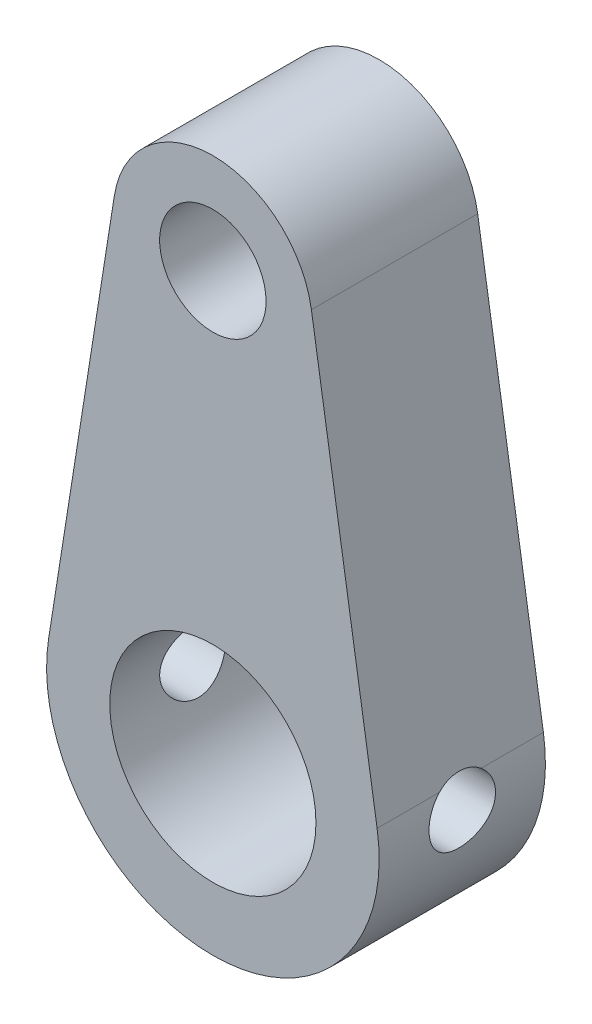
from build123d import *

# Parameters (mm, degrees)
CROQUIS1_R                 = 3.1
CROQUIS1_R_2               = 1.6
SALIENTE_EXTRUIR1_DEPTH    = 5
CORTAR_EXTRUIR1_DEPTH      = 18.33749982
CORTAR_EXTRUIR1_DEPTH_BACK = 18.33749982
CROQUIS3_R                 = 1


with BuildPart() as part:
    # Croquis1 → Saliente-Extruir1 (new body)
    with BuildSketch(Plane.XY):
        with BuildLine():
            Line((-4.938876333, 0.779423227), (-2.9633258, 13.297653936))
            ThreePointArc((-2.9633258, 13.297653936), (0, 15.83), (2.9633258, 13.297653936))
            Line((2.9633258, 13.297653936), (4.938876333, 0.779423227))
            ThreePointArc((4.938876333, 0.779423227), (0, -5), (-4.938876333, 0.779423227))
        make_face()
        Circle(CROQUIS1_R, mode=Mode.SUBTRACT)
        with Locations((0, 12.83)):
            Circle(CROQUIS1_R_2, mode=Mode.SUBTRACT)
    extrude(amount=SALIENTE_EXTRUIR1_DEPTH)

    # Croquis3 → Cortar-Extruir1 (cut, two sides: drawn at the far end of the back side and taken through both)
    with BuildSketch(Plane(origin=(0, 0, 0), x_dir=(0, 0, -1), z_dir=(1, 0, 0)).offset(-CORTAR_EXTRUIR1_DEPTH_BACK)):
        with Locations((-2.5, 0)):
            Circle(CROQUIS3_R)
    extrude(amount=CORTAR_EXTRUIR1_DEPTH + CORTAR_EXTRUIR1_DEPTH_BACK, mode=Mode.SUBTRACT)


solid = part.part
